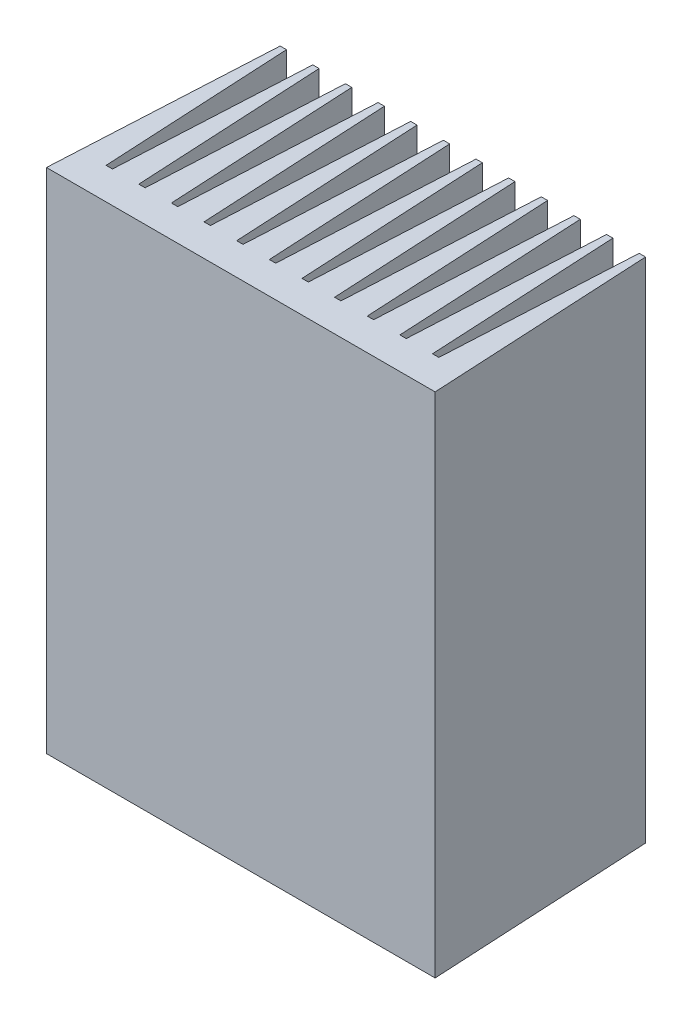
from build123d import *

# Parameters (mm, degrees)
BOSS_EXTRUDE2_DEPTH = 80


with BuildPart() as part:
    # Sketch1 → Boss-Extrude2 (new body)
    with BuildSketch(Plane(origin=(0, 0, 0), x_dir=(1, 0, 0), z_dir=(0, 1, 0))):
        Polygon((0, -5), (-30.628839438, -5), (-28.794567163, 30), (-27.794567163, 30), (-26.222333785, 0), (-25.722333785, 0), (-25.222333785, 0), (-23.650100406, 30), (-22.650100406, 30), (-21.077867028, 0), (-20.577867028, 0), (-20.077867028, 0), (-18.505633649, 30), (-17.505633649, 30), (-15.933400271, 0), (-15.433400271, 0), (-14.933400271, 0), (-13.361166892, 30), (-12.361166892, 30), (-10.788933514, 0), (-10.288933514, 0), (-9.788933514, 0), (-8.216700135, 30), (-7.216700135, 30), (-5.644466757, 0), (-5.144466757, 0), (-4.644466757, 0), (-3.072233378, 30), (-2.072233378, 30), (-0.5, 0), (0, 0), align=None)
        Polygon((0, 0), (0.5, 0), (2.072233378, 30), (3.072233378, 30), (4.644466757, 0), (5.144466757, 0), (5.644466757, 0), (7.216700135, 30), (8.216700135, 30), (9.788933514, 0), (10.288933514, 0), (10.788933514, 0), (12.361166892, 30), (13.361166892, 30), (14.933400271, 0), (15.433400271, 0), (15.933400271, 0), (17.505633649, 30), (18.505633649, 30), (20.077867028, 0), (20.577867028, 0), (21.077867028, 0), (22.650100406, 30), (23.650100406, 30), (25.222333785, 0), (25.722333785, 0), (26.222333785, 0), (27.794567163, 30), (28.794567163, 30), (30.628839438, -5), (0, -5), align=None)
    extrude(amount=BOSS_EXTRUDE2_DEPTH)


solid = part.part
